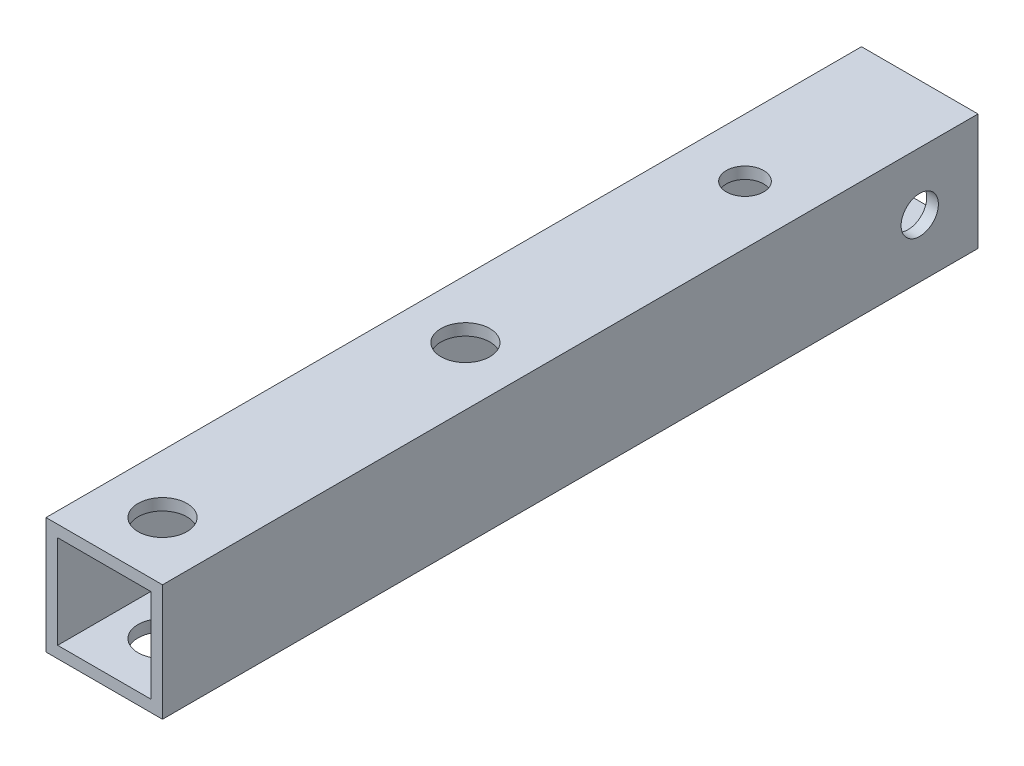
from build123d import *

# Parameters (mm, degrees)
SKETCH_1_W          = 10
SKETCH_1_H          = 10
SKETCH_1_W_2        = 8
SKETCH_1_H_2        = 8
EXTRUDE_1_DEPTH     = 60
SKETCH_3_R          = 2.1
SKETCH_3_R_2        = 1.6
CUT_EXTRUDE_1_DEPTH = 62.032778079
SKETCH_7_W          = 10
SKETCH_7_H          = 10
SKETCH_7_W_2        = 8
SKETCH_7_H_2        = 8
EXTRUDE_1_2_DEPTH   = 10
SKETCH_8_R          = 1.6
CUT_EXTRUDE_5_DEPTH = 62.032778079


with BuildPart() as part:
    # ｽｹｯﾁ1 → Extrude 1 (new body)
    with BuildSketch(Plane.XY):
        Rectangle(SKETCH_1_W, SKETCH_1_H)
        Rectangle(SKETCH_1_W_2, SKETCH_1_H_2, mode=Mode.SUBTRACT)
    extrude(amount=EXTRUDE_1_DEPTH)

    # ｽｹｯﾁ3 → ｶｯﾄ - 押し出し1 (cut, through all)
    with BuildSketch(Plane(origin=(0, 5, 0), x_dir=(1, 0, 0), z_dir=(0, 1, 0))):
        with Locations(Location((0, -55, 0), (0, 0, 180))):
            Circle(SKETCH_3_R)
        with Locations(Location((0, -29, 0), (0, 0, 180))):
            Circle(SKETCH_3_R)
        with Locations(Location((0, -5, 0), (0, 0, 180))):
            Circle(SKETCH_3_R_2)
    extrude(amount=-CUT_EXTRUDE_1_DEPTH, mode=Mode.SUBTRACT)

    # ｽｹｯﾁ7 → Extrude 1 2 (add)
    with BuildSketch(Plane(origin=(0, 0, 0), x_dir=(-1, 0, 0), z_dir=(0, 0, -1))):
        Rectangle(SKETCH_7_W, SKETCH_7_H)
        Rectangle(SKETCH_7_W_2, SKETCH_7_H_2, mode=Mode.SUBTRACT)
    extrude(amount=EXTRUDE_1_2_DEPTH)

    # ｽｹｯﾁ8 → ｶｯﾄ - 押し出し5 (cut, through all)
    with BuildSketch(Plane.ZY.offset(5)):
        with Locations(Location((-5, 0, 0), (0, 0, 270))):
            Circle(SKETCH_8_R)
    extrude(amount=-CUT_EXTRUDE_5_DEPTH, mode=Mode.SUBTRACT)


solid = part.part
